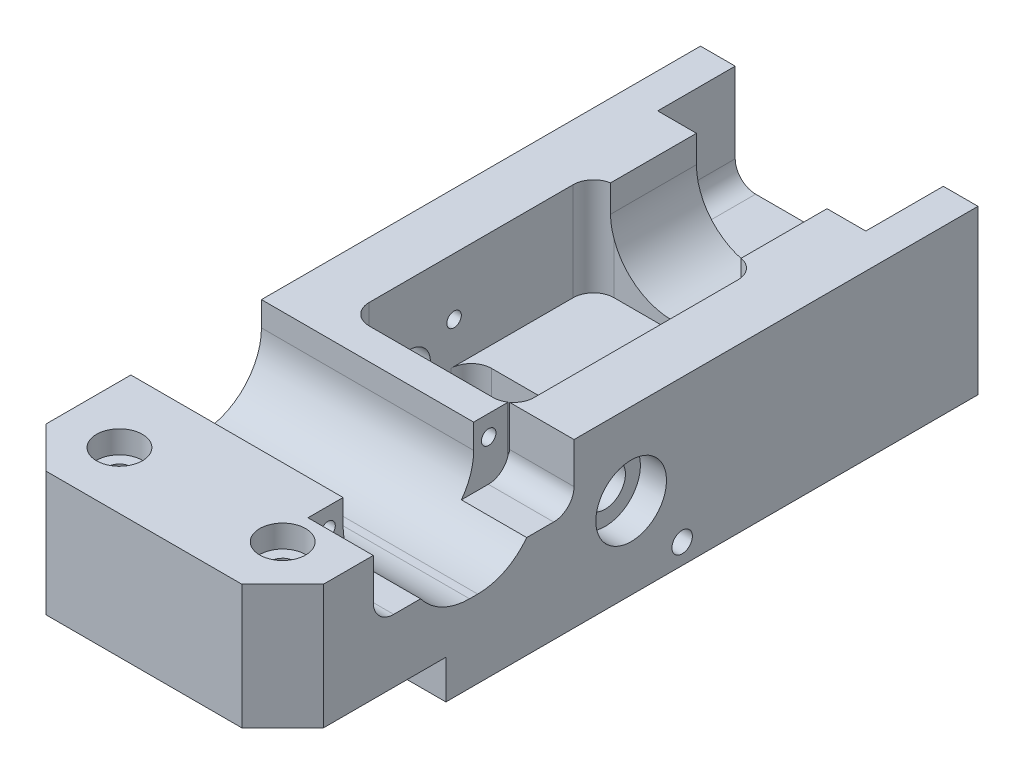
from build123d import *

# Parameters (mm, degrees)
BASE_DEPTH                    = 12.7
BASE_DEPTH_BACK               = 12.7
SKETCH1_W                     = 43.18
SKETCH1_H                     = 108.204
ACTUATORPLANECUT_DEPTH        = 6.0325
CENTERSLOT_DEPTH              = 60.619162222
CENTERSLOT_DEPTH_BACK         = 60.619162222
SKETCH5_W                     = 25.654
SKETCH5_H                     = 19.05
SHAFTGUIDE_REACH              = 113.065
SKETCH2_R                     = 4.7625
CENTERSLOTFILLET_R            = 3.175
GEARBOXPIT_DEPTH              = 11.176
FRONTCUTAWAY_DEPTH            = 15.24
GEARBOXSLOTSH_DEPTH           = 2.286
SKETCH55_R                    = 1.5875
GUIDEBARHOLE_DEPTH            = 71.376336961
PITCHSHAFTHOLE_DEPTH          = 60.619162279
PITCHSHAFTHOLE_DEPTH_BACK     = 60.619162279
SKETCH56_R                    = 3.175
SKETCH57_R                    = 5.5
BEARINGBORER_DEPTH            = 4.064
TOGGLEASSEMHOLES_D            = 2.7051
TOGGLEASSEMHOLES_DEPTH        = 9.398
TOGGLEASSEMHOLES_TIP          = 0.81269403
BACKCHAMFERS_SIZE             = 6.35
PITCHMOTORSLOT_DEPTH          = 71.37633704
PITCHMOTORMOUNTINGSLOTS_DEPTH = 10.16
PITCHMOTORMOUNTINGHOLES_D     = 2.2606
PITCHMOTORMOUNTINGHOLES_DEPTH = 7.5946
PITCHMOTORMOUNTINGHOLES_TIP   = 0.679152758
GEARBOXMOUNTINGHOLES_D        = 2.7051
GEARBOXMOUNTINGHOLES_DEPTH    = 9.398
GEARBOXMOUNTINGHOLES_TIP      = 0.81269403
CAPMOUNTINGHOLES_D            = 3.6576
CAPMOUNTINGHOLES_CBORE_D      = 7.14502
CAPMOUNTINGHOLES_CBORE_DEPTH  = 3.5052
ENCODERMOUNTINGHOLES_D        = 2.2606
ENCODERMOUNTINGHOLES_DEPTH    = 10.1346
ENCODERMOUNTINGHOLES_TIP      = 0.679152758
ROLLMOTORSLOT_REACH           = 113.065
ROLLMOTORMOUNTINGSLOTS_DEPTH  = 12.065
ROLLMOTORMOUNTINGHOLES_D      = 2.2606
ROLLMOTORMOUNTINGHOLES_DEPTH  = 7.62
ROLLMOTORMOUNTINGHOLES_TIP    = 0.679152758


with BuildPart() as part:
    # Sketch1 → Base (new, two sides: drawn at the far end of the back side and taken through both)
    with BuildSketch(Plane(origin=(0, 0, 0), x_dir=(1, 0, 0), z_dir=(0, 1, 0)).offset(-BASE_DEPTH_BACK)):
        Rectangle(SKETCH1_W, SKETCH1_H)
    extrude(amount=BASE_DEPTH + BASE_DEPTH_BACK)

    # Sketch3 → ActuatorPlaneCut (cut)
    with BuildSketch(Plane(origin=(0, -12.7, 0), x_dir=(-1, 0, 0), z_dir=(0, -1, 0))):
        Polygon((10.922, -28.702), (16.256, -28.702), (21.59, -28.702), (21.59, -54.102), (-21.59, -54.102), (-21.59, -28.702), (-10.922, -28.702), (-10.922, -11.176), (10.922, -11.176), align=None)
    extrude(amount=-ACTUATORPLANECUT_DEPTH, mode=Mode.SUBTRACT)

    # Sketch5 → CenterSlot (cut, two sides: drawn at the far end of the back side and taken through both)
    with BuildSketch(Plane(origin=(0, 0, 0), x_dir=(1, 0, 0), z_dir=(0, 1, 0)).offset(-CENTERSLOT_DEPTH_BACK)):
        with Locations((0, 0.127)):
            Rectangle(SKETCH5_W, SKETCH5_H)
    extrude(amount=CENTERSLOT_DEPTH + CENTERSLOT_DEPTH_BACK, mode=Mode.SUBTRACT)

    # Sketch2 → ShaftGuide (cut, up to next)
    with BuildSketch(Plane(origin=(0, 0, -54.102), x_dir=(-1, 0, 0), z_dir=(0, 0, -1)), mode=Mode.PRIVATE) as shaftguide_sk1:
        with Locations((0, -12.7)):
            Circle(SKETCH2_R)
    shaftguide_tool1 = extrude(shaftguide_sk1.sketch, amount=-SHAFTGUIDE_REACH, mode=Mode.PRIVATE) & part.part
    add(shaftguide_tool1.solids().sort_by_distance((0, -12.7, -54.102))[0], mode=Mode.SUBTRACT)

    # CenterSlotFillet
    centerslotfillet_edges = [part.edges().sort_by_distance(p)[0] for p in [
        (-12.827, 0, -9.652),
        (-12.827, 0, 9.398),
        (12.827, 0, 9.398),
        (12.827, 0, -9.652),
    ]]
    fillet(centerslotfillet_edges, radius=CENTERSLOTFILLET_R)

    # Sketch40 → GearBoxPit (cut)
    with BuildSketch(Plane.XZ.offset(12.7)):
        with BuildLine():
            Line((10.922, 6.858), (-10.922, 6.858))
            Line((-10.922, 6.858), (-10.922, 25.527))
            ThreePointArc((-10.922, 25.527), (-9.99206403, 27.77206403), (-7.747, 28.702))
            Line((-7.747, 28.702), (7.747, 28.702))
            ThreePointArc((7.747, 28.702), (9.99206403, 27.77206403), (10.922, 25.527))
            Line((10.922, 25.527), (10.922, 6.858))
        make_face()
    extrude(amount=-GEARBOXPIT_DEPTH, mode=Mode.SUBTRACT)

    # Sketch60 → FrontCutaway (cut)
    with BuildSketch(Plane(origin=(0, 12.7, 0), x_dir=(1, 0, 0), z_dir=(0, 1, 0))):
        with BuildLine():
            Line((-12.827, 6.477), (12.827, 6.477))
            Line((12.827, 6.477), (12.827, 25.527))
            ThreePointArc((12.827, 25.527), (11.89706403, 27.77206403), (9.652, 28.702))
            Line((9.652, 28.702), (-9.652, 28.702))
            ThreePointArc((-9.652, 28.702), (-11.89706403, 27.77206403), (-12.827, 25.527))
            Line((-12.827, 25.527), (-12.827, 6.477))
        make_face()
    extrude(amount=-FRONTCUTAWAY_DEPTH, mode=Mode.SUBTRACT)

    # Sketch67 → GearBoxSlotsH (cut)
    with BuildSketch(Plane(origin=(0, -12.7, 0), x_dir=(-1, 0, 0), z_dir=(0, -1, 0))):
        with BuildLine():
            Line((-12.3825, -12.811125), (12.3825, -12.811125))
            ThreePointArc((12.3825, -12.811125), (12.779375, -13.208), (12.3825, -13.604875))
            Line((12.3825, -13.604875), (-12.3825, -13.604875))
            ThreePointArc((-12.3825, -13.604875), (-12.779375, -13.208), (-12.3825, -12.811125))
        make_face()
        with BuildLine():
            Line((-12.3825, -23.479125), (12.3825, -23.479125))
            ThreePointArc((12.3825, -23.479125), (12.779375, -23.876), (12.3825, -24.272875))
            Line((12.3825, -24.272875), (-12.3825, -24.272875))
            ThreePointArc((-12.3825, -24.272875), (-12.779375, -23.876), (-12.3825, -23.479125))
        make_face()
    extrude(amount=-GEARBOXSLOTSH_DEPTH, mode=Mode.SUBTRACT)

    # Sketch55 → GuideBarHole (cut, through all)
    with BuildSketch(Plane.ZY.offset(21.59)):
        with Locations((-8.0645, -9.525)):
            Circle(SKETCH55_R)
    extrude(amount=-GUIDEBARHOLE_DEPTH, mode=Mode.SUBTRACT)

    # Sketch56 → PitchShaftHole (cut, two sides: drawn at the far end of the back side and taken through both)
    with BuildSketch(Plane(origin=(0, 0, 0), x_dir=(0, 0, -1), z_dir=(1, 0, 0)).offset(-PITCHSHAFTHOLE_DEPTH_BACK)):
        with Locations((0.127, 0)):
            Circle(SKETCH56_R)
    extrude(amount=PITCHSHAFTHOLE_DEPTH + PITCHSHAFTHOLE_DEPTH_BACK, mode=Mode.SUBTRACT)

    # Sketch57 → BearingBoreR (cut)
    with BuildSketch(Plane.ZY.offset(21.59)):
        with Locations((-0.127, 0)):
            Circle(SKETCH57_R)
    bearingborer = extrude(amount=-BEARINGBORER_DEPTH, mode=Mode.SUBTRACT)

    # BearingBoreL: BearingBoreR across plane
    add(bearingborer.mirror(Plane(origin=(0, 0, 0), x_dir=(0, 0, 1), z_dir=(1, 0, 0))), mode=Mode.SUBTRACT)

    # ToggleAssemHoles
    with Locations(Plane(origin=(0, -12.7, 0), x_dir=(-1, 0, 0), z_dir=(0, -1, 0))):
        with Locations((15.875, 22.352), (-15.875, 22.352)):
            Hole(TOGGLEASSEMHOLES_D / 2, depth=TOGGLEASSEMHOLES_DEPTH)
            with Locations((0, 0, -(TOGGLEASSEMHOLES_DEPTH + TOGGLEASSEMHOLES_TIP / 2))):  # 118° drill point
                Cone(0, TOGGLEASSEMHOLES_D / 2, TOGGLEASSEMHOLES_TIP, mode=Mode.SUBTRACT)

    # BackChamfers
    backchamfers_edges = [part.edges().sort_by_distance(p)[0] for p in [
        (21.59, 3.01625, 54.102),
        (-21.59, 3.01625, 54.102),
    ]]
    chamfer(backchamfers_edges, length=BACKCHAMFERS_SIZE)

    # Sketch62 → PitchMotorSlot (cut, through all)
    with BuildSketch(Plane.ZY.offset(21.59)):
        with BuildLine():
            Line((14.224, 9.525), (14.224, 12.7))
            Line((14.224, 12.7), (34.544, 12.7))
            Line((34.544, 12.7), (34.544, 9.525))
            Line((34.544, 9.525), (34.544, 8.89))
            ThreePointArc((34.544, 8.89), (31.754192091, 2.154807909), (25.019, -0.635))
            Line((25.019, -0.635), (23.749, -0.635))
            ThreePointArc((23.749, -0.635), (17.013807909, 2.154807909), (14.224, 8.89))
            Line((14.224, 8.89), (14.224, 9.525))
        make_face()
    extrude(amount=-PITCHMOTORSLOT_DEPTH, mode=Mode.SUBTRACT)

    # Sketch63 → PitchMotorMountingSlots (cut)
    with BuildSketch(Plane.ZY.offset(-21.59)):
        with BuildLine():
            Line((8.763, 12.7), (40.005, 12.7))
            Line((40.005, 12.7), (40.005, 6.35))
            ThreePointArc((40.005, 6.35), (39.07506403, 4.10493597), (36.83, 3.175))
            Line((36.83, 3.175), (11.938, 3.175))
            ThreePointArc((11.938, 3.175), (9.69293597, 4.10493597), (8.763, 6.35))
            Line((8.763, 6.35), (8.763, 12.7))
        make_face()
    extrude(amount=PITCHMOTORMOUNTINGSLOTS_DEPTH, mode=Mode.SUBTRACT)

    # PitchMotorMountingHoles
    with Locations(Plane(origin=(11.43, 0, 0), x_dir=(0, 0, -1), z_dir=(1, 0, 0))):
        with Locations((-36.884, 9.525), (-11.884, 9.525)):
            Hole(PITCHMOTORMOUNTINGHOLES_D / 2, depth=PITCHMOTORMOUNTINGHOLES_DEPTH)
            with Locations((0, 0, -(PITCHMOTORMOUNTINGHOLES_DEPTH + PITCHMOTORMOUNTINGHOLES_TIP / 2))):  # 118° drill point
                Cone(0, PITCHMOTORMOUNTINGHOLES_D / 2, PITCHMOTORMOUNTINGHOLES_TIP, mode=Mode.SUBTRACT)

    # GearBoxMountingHoles
    with Locations(Plane(origin=(0, -12.7, 0), x_dir=(-1, 0, 0), z_dir=(0, -1, 0))):
        with Locations((-16.256, -18.542), (16.256, -18.542)):
            Hole(GEARBOXMOUNTINGHOLES_D / 2, depth=GEARBOXMOUNTINGHOLES_DEPTH)
            with Locations((0, 0, -(GEARBOXMOUNTINGHOLES_DEPTH + GEARBOXMOUNTINGHOLES_TIP / 2))):  # 118° drill point
                Cone(0, GEARBOXMOUNTINGHOLES_D / 2, GEARBOXMOUNTINGHOLES_TIP, mode=Mode.SUBTRACT)

    # CapMountingHoles (through all)
    with Locations(Plane(origin=(-0.837932951, 12.7, 8.633720573), x_dir=(-1, 0, 0), z_dir=(0, 1, 0))):
        with Locations((-13.537932951, 36.578279427), (11.862067049, 36.578279427)):
            CounterBoreHole(CAPMOUNTINGHOLES_D / 2, CAPMOUNTINGHOLES_CBORE_D / 2, CAPMOUNTINGHOLES_CBORE_DEPTH)

    # EncoderMountingHoles
    with Locations(Plane.ZY.offset(21.59)):
        with Locations((6.731, 3.81), (-6.985, 3.81)):
            Hole(ENCODERMOUNTINGHOLES_D / 2, depth=ENCODERMOUNTINGHOLES_DEPTH)
            with Locations((0, 0, -(ENCODERMOUNTINGHOLES_DEPTH + ENCODERMOUNTINGHOLES_TIP / 2))):  # 118° drill point
                Cone(0, ENCODERMOUNTINGHOLES_D / 2, ENCODERMOUNTINGHOLES_TIP, mode=Mode.SUBTRACT)

    # Sketch81 → RollMotorSlot (cut, up to next)
    with BuildSketch(Plane(origin=(0, 0, -54.102), x_dir=(-1, 0, 0), z_dir=(0, 0, -1)), mode=Mode.PRIVATE) as rollmotorslot_sk1:
        with BuildLine():
            Line((10.16, 12.7), (-10.16, 12.7))
            Line((-10.16, 12.7), (-10.16, 8.46582))
            ThreePointArc((-10.16, 8.46582), (-7.370192091, 1.730627909), (-0.635, -1.05918))
            Line((-0.635, -1.05918), (0.635, -1.05918))
            ThreePointArc((0.635, -1.05918), (7.370192091, 1.730627909), (10.16, 8.46582))
            Line((10.16, 8.46582), (10.16, 12.7))
        make_face()
    rollmotorslot_tool1 = extrude(rollmotorslot_sk1.sketch, amount=-ROLLMOTORSLOT_REACH, mode=Mode.PRIVATE) & part.part
    add(rollmotorslot_tool1.solids().sort_by_distance((0, 6.589347, -54.102))[0], mode=Mode.SUBTRACT)

    # Sketch84 → RollMotorMountingSlots (cut)
    with BuildSketch(Plane(origin=(0, 0, -54.102), x_dir=(-1, 0, 0), z_dir=(0, 0, -1))):
        with BuildLine():
            Line((16.1925, 12.7), (-16.1925, 12.7))
            Line((-16.1925, 12.7), (-16.1925, 0.21082))
            ThreePointArc((-16.1925, 0.21082), (-15.26256403, -2.03424403), (-13.0175, -2.96418))
            Line((-13.0175, -2.96418), (13.0175, -2.96418))
            ThreePointArc((13.0175, -2.96418), (15.26256403, -2.03424403), (16.1925, 0.21082))
            Line((16.1925, 0.21082), (16.1925, 12.7))
        make_face()
    extrude(amount=-ROLLMOTORMOUNTINGSLOTS_DEPTH, mode=Mode.SUBTRACT)

    # RollMotorMountingHoles
    with Locations(Plane(origin=(0, 0, -42.037), x_dir=(-1, 0, 0), z_dir=(0, 0, -1))):
        with Locations((12.5, 8.46582), (-12.5, 8.46582)):
            Hole(ROLLMOTORMOUNTINGHOLES_D / 2, depth=ROLLMOTORMOUNTINGHOLES_DEPTH)
            with Locations((0, 0, -(ROLLMOTORMOUNTINGHOLES_DEPTH + ROLLMOTORMOUNTINGHOLES_TIP / 2))):  # 118° drill point
                Cone(0, ROLLMOTORMOUNTINGHOLES_D / 2, ROLLMOTORMOUNTINGHOLES_TIP, mode=Mode.SUBTRACT)


solid = part.part
